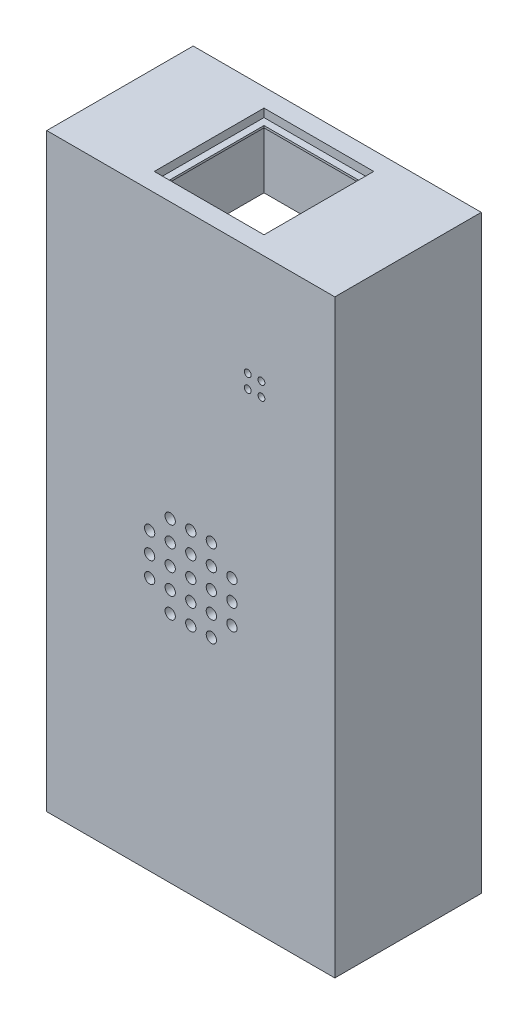
from build123d import *

# Parameters (mm, degrees)
EXTRUDE_270_DEPTH      = 15
EXTRUDE_270_DEPTH_BACK = 6.35
SKETCH_219_W           = 42
SKETCH_219_H           = 86
SKETCH_342_W           = 38.4
SKETCH_342_H           = 58.4
CUT_EXTRUDE_385_DEPTH  = 86.41324546
PCB_2_W                = 31
PCB_2_H                = 51
PCB_DEPTH              = 17.35
SKETCH_X4_R            = 0.8
CUT_EXTRUDE_X4_DEPTH   = 6
SKETCH_609_W           = 16
SKETCH_609_H           = 16
CUT_EXTRUDE_653_DEPTH  = 1.2
SKETCH_705_W           = 14
SKETCH_705_H           = 14
CUT_EXTRUDE_749_DEPTH  = 1.5
SKETCH_812_W           = 15.6
SKETCH_812_H           = 15.6
CUT_EXTRUDE_856_DEPTH  = 9.5
SKETCH_919_R           = 0.75
CUT_EXTRUDE_976_DEPTH  = 2
SKETCH_1020_R          = 0.5
CUT_EXTRUDE_1043_DEPTH = 2
SKETCH_1098_W          = 5.387259859
SKETCH_1098_H          = 0.728008089
SKETCH_1098_H_2        = 0.752275025
CUT_EXTRUDE_1476_DEPTH = 0.3


with BuildPart() as part:
    # Sketch 219 → Extrude 270 (new, two sides: drawn at the far end of the back side and taken through both)
    with BuildSketch(Plane.XY.offset(-EXTRUDE_270_DEPTH_BACK)):
        with Locations((15, -32)):
            Rectangle(SKETCH_219_W, SKETCH_219_H)
    extrude(amount=EXTRUDE_270_DEPTH + EXTRUDE_270_DEPTH_BACK)

    # Sketch 342 → Cut-Extrude 385 (cut, through all)
    with BuildSketch(Plane.XY.offset(-4.35)):
        with Locations((15, -25)):
            Rectangle(SKETCH_342_W, SKETCH_342_H)
    extrude(amount=-CUT_EXTRUDE_385_DEPTH, mode=Mode.SUBTRACT)

    # PCB 2 → PCB (cut)
    with BuildSketch(Plane.XY.offset(-4.35)):
        with Locations((15, -25)):
            Rectangle(PCB_2_W, PCB_2_H)
    extrude(amount=PCB_DEPTH, mode=Mode.SUBTRACT)

    # 螺丝底孔x4_草图 → 螺丝底孔x4 (cut)
    with BuildSketch(Plane.XY.offset(-4.35)):
        with Locations((-2, 2)):
            Circle(SKETCH_X4_R)
        with Locations((32, 2)):
            Circle(SKETCH_X4_R)
        with Locations((-2, -52)):
            Circle(SKETCH_X4_R)
        with Locations((32, -52)):
            Circle(SKETCH_X4_R)
    extrude(amount=CUT_EXTRUDE_X4_DEPTH, mode=Mode.SUBTRACT)

    # Sketch 609 → Cut-Extrude 653 (cut)
    with BuildSketch(Plane(origin=(0, 11, 0), x_dir=(1, 0, 0), z_dir=(0, 1, 0))):
        with Locations((15, -4.325)):
            Rectangle(SKETCH_609_W, SKETCH_609_H)
    extrude(amount=-CUT_EXTRUDE_653_DEPTH, mode=Mode.SUBTRACT)

    # Sketch 705 → Cut-Extrude 749 (cut)
    with BuildSketch(Plane(origin=(0, 11, 0), x_dir=(1, 0, 0), z_dir=(0, 1, 0))):
        with Locations((15, -4.325)):
            Rectangle(SKETCH_705_W, SKETCH_705_H)
    extrude(amount=-CUT_EXTRUDE_749_DEPTH, mode=Mode.SUBTRACT)

    # Sketch 812 → Cut-Extrude 856 (cut)
    with BuildSketch(Plane(origin=(0, 9.5, 0), x_dir=(1, 0, 0), z_dir=(0, 1, 0))):
        with Locations((15, -4.325)):
            Rectangle(SKETCH_812_W, SKETCH_812_H)
    extrude(amount=-CUT_EXTRUDE_856_DEPTH, mode=Mode.SUBTRACT)

    # Sketch 919 → Cut-Extrude 976 (cut)
    with BuildSketch(Plane.XY.offset(15)):
        with Locations((9, -38)):
            Circle(SKETCH_919_R)
        with Locations((9, -35)):
            Circle(SKETCH_919_R)
        with Locations((9, -32)):
            Circle(SKETCH_919_R)
        with Locations((12, -41)):
            Circle(SKETCH_919_R)
        with Locations((12, -38)):
            Circle(SKETCH_919_R)
        with Locations((12, -35)):
            Circle(SKETCH_919_R)
        with Locations((12, -32)):
            Circle(SKETCH_919_R)
        with Locations((12, -29)):
            Circle(SKETCH_919_R)
        with Locations((15, -41)):
            Circle(SKETCH_919_R)
        with Locations((15, -38)):
            Circle(SKETCH_919_R)
        with Locations((15, -35)):
            Circle(SKETCH_919_R)
        with Locations((15, -32)):
            Circle(SKETCH_919_R)
        with Locations((15, -29)):
            Circle(SKETCH_919_R)
        with Locations((18, -41)):
            Circle(SKETCH_919_R)
        with Locations((18, -38)):
            Circle(SKETCH_919_R)
        with Locations((18, -35)):
            Circle(SKETCH_919_R)
        with Locations((18, -32)):
            Circle(SKETCH_919_R)
        with Locations((18, -29)):
            Circle(SKETCH_919_R)
        with Locations((21, -38)):
            Circle(SKETCH_919_R)
        with Locations((21, -35)):
            Circle(SKETCH_919_R)
        with Locations((21, -32)):
            Circle(SKETCH_919_R)
    extrude(amount=-CUT_EXTRUDE_976_DEPTH, mode=Mode.SUBTRACT)

    # Sketch 1020 → Cut-Extrude 1043 (cut)
    with BuildSketch(Plane.XY.offset(15)):
        with Locations((23.3, -7)):
            Circle(SKETCH_1020_R)
        with Locations((23.3, -5)):
            Circle(SKETCH_1020_R)
        with Locations((25.3, -7)):
            Circle(SKETCH_1020_R)
        with Locations((25.3, -5)):
            Circle(SKETCH_1020_R)
    extrude(amount=-CUT_EXTRUDE_1043_DEPTH, mode=Mode.SUBTRACT)

    # Sketch 1098 → Cut-Extrude 1476 (cut)
    # profile 1 of 2: a face of its own
    with BuildSketch(Plane.XY.offset(-6.35)):
        Polygon((27.121334681, -65.491809909), (25.713852376, -65.491809909), (25.713852376, -59.71627907), (23.038422649, -59.71627907), (22.449949444, -58.6), (22.09032693, -58.636400404), (21.747556454, -58.672800809), (21.421638018, -58.709201213), (21.112571621, -58.745601618), (20.820357263, -58.782002022), (20.544994944, -58.818402427), (21.127401416, -59.71627907), (17.026289181, -59.71627907), (17.026289181, -64.642467139), (16.861813279, -64.512369397), (16.700033704, -64.380923492), (16.540950455, -64.248129424), (16.384563532, -64.113987192), (16.230872936, -63.978496798), (16.079878665, -63.841658241), (15.060667341, -64.982204247), (15.368048534, -65.231108864), (15.683518706, -65.476306033), (16.007077856, -65.717795753), (16.338725986, -65.955578025), (16.678463094, -66.189652848), (17.026289181, -66.420020222), (17.026289181, -68.513043478), (17.076845298, -69.118031682), (17.22851365, -69.614492754), (17.481294237, -70.002426694), (17.835187058, -70.281833502), (18.290192113, -70.452713178), (18.846309403, -70.515065723), (20.896865521, -70.515065723), (20.951803168, -70.18173239), (21.003370408, -69.877384564), (21.05156724, -69.602022245), (21.096393664, -69.355645433), (21.13784968, -69.138254129), (21.175935288, -68.949848332), (20.889450624, -68.968385575), (20.596225143, -68.98355241), (20.296258847, -68.995348837), (19.989551736, -69.003774857), (19.676103809, -69.008830468), (19.355915066, -69.010515672), (19.148297944, -68.991641389), (18.97842939, -68.935018537), (18.846309403, -68.840647118), (18.751937984, -68.708527132), (18.695315133, -68.538658578), (18.676440849, -68.331041456), (18.676440849, -67.396764408), (19.798786653, -67.970407819), (20.985844287, -68.514391641), (22.237613751, -69.028715875), (23.554095046, -69.513380519), (24.93528817, -69.968385575), (26.381193124, -70.393731041), (26.543983822, -70.051971689), (26.700707786, -69.738523761), (26.851365015, -69.45338726), (26.995955511, -69.196562184), (27.134479272, -68.968048534), (27.266936299, -68.767846309), (26.116616111, -68.531917762), (25.011459387, -68.269025952), (23.951466127, -67.97917088), (22.936636333, -67.662352545), (21.966970003, -67.318570947), (21.042467139, -66.947826087), (27.121334681, -66.947826087), align=None)
        with Locations((21.370070779, -61.512032356)):
            Rectangle(SKETCH_1098_W, SKETCH_1098_H, mode=Mode.SUBTRACT)
        with Locations((21.370070779, -63.307785643)):
            Rectangle(SKETCH_1098_W, SKETCH_1098_H, mode=Mode.SUBTRACT)
        with Locations((21.370070779, -65.115672397)):
            Rectangle(SKETCH_1098_W, SKETCH_1098_H_2, mode=Mode.SUBTRACT)
    # profile 2 of 2: a face of its own
    with BuildSketch(Plane.XY.offset(-6.35)):
        Polygon((12.852376138, -58.660667341), (11.287158746, -59.06107179), (11.424671385, -59.572868217), (11.566228514, -60.072868217), (11.711830131, -60.56107179), (11.861476239, -61.037478935), (12.015166835, -61.502089653), (12.172901921, -61.954903943), (12.172901921, -66.887158746), (11.553589484, -66.192517695), (10.989888777, -65.459453994), (10.481799798, -64.687967644), (10.029322548, -63.878058645), (9.632457027, -63.029726997), (9.291203236, -62.1429727), (11.481294237, -62.1429727), (11.481294237, -60.626289181), (8.31445905, -60.626289181), (8.31445905, -58.660667341), (6.712841254, -58.660667341), (6.712841254, -60.626289181), (3.218402427, -60.626289181), (3.218402427, -62.1429727), (5.833164813, -62.1429727), (5.490899899, -62.985911695), (5.078867543, -63.795820694), (4.597067745, -64.572699697), (4.045500506, -65.316548702), (3.424165824, -66.027367711), (2.733063701, -66.705156724), (2.907313785, -66.972093023), (3.082237951, -67.247118301), (3.257836198, -67.530232558), (3.434108527, -67.821435794), (3.611054938, -68.120728008), (3.78867543, -68.428109201), (3.948769801, -68.257229525), (4.105493765, -68.080283114), (4.258847321, -67.89726997), (4.408830468, -67.708190091), (4.555443209, -67.513043478), (4.698685541, -67.311830131), (4.698685541, -68.561577351), (6.712841254, -68.561577351), (6.712841254, -70.6), (8.31445905, -70.6), (8.31445905, -68.561577351), (10.267947422, -68.561577351), (10.267947422, -67.263296259), (10.426019548, -67.494169194), (10.588810246, -67.721671722), (10.756319515, -67.945803842), (10.928547354, -68.166565554), (11.105493765, -68.383956859), (11.287158746, -68.597977755), (11.411189754, -68.397944051), (11.544657904, -68.18611392), (11.687563195, -67.962487361), (11.839905629, -67.727064375), (12.001685204, -67.479844961), (12.172901921, -67.22082912), (12.172901921, -70.575733064), (13.628918099, -70.575733064), (13.628918099, -65.237007078), (13.759015841, -65.466868891), (13.890461746, -65.691338052), (14.023255814, -65.91041456), (14.157398045, -66.124098416), (14.29288844, -66.332389619), (14.429726997, -66.53528817), (14.480957196, -66.164880351), (14.537580047, -65.78975396), (14.599595551, -65.409908999), (14.667003707, -65.025345467), (14.739804516, -64.636063364), (14.817997978, -64.24206269), (14.497135153, -63.588203573), (14.173576003, -62.823795079), (13.847320526, -61.948837209), (13.518368723, -60.963329963), (13.186720593, -59.86727334), align=None)
        Polygon((10.11627907, -67.032760364), (8.31445905, -67.032760364), (8.31445905, -62.82851365), (8.526289181, -63.587360971), (8.773508595, -64.322952477), (9.05611729, -65.03528817), (9.374115268, -65.724368049), (9.727502528, -66.390192113), align=None, mode=Mode.SUBTRACT)
        Polygon((6.712841254, -62.895247725), (6.712841254, -67.032760364), (4.886754297, -67.032760364), (5.244186047, -66.44934277), (5.580384226, -65.823458038), (5.895348837, -65.155106168), (6.189079879, -64.444287159), (6.461577351, -63.691001011), align=None, mode=Mode.SUBTRACT)
    extrude(amount=CUT_EXTRUDE_1476_DEPTH, mode=Mode.SUBTRACT)


solid = part.part
